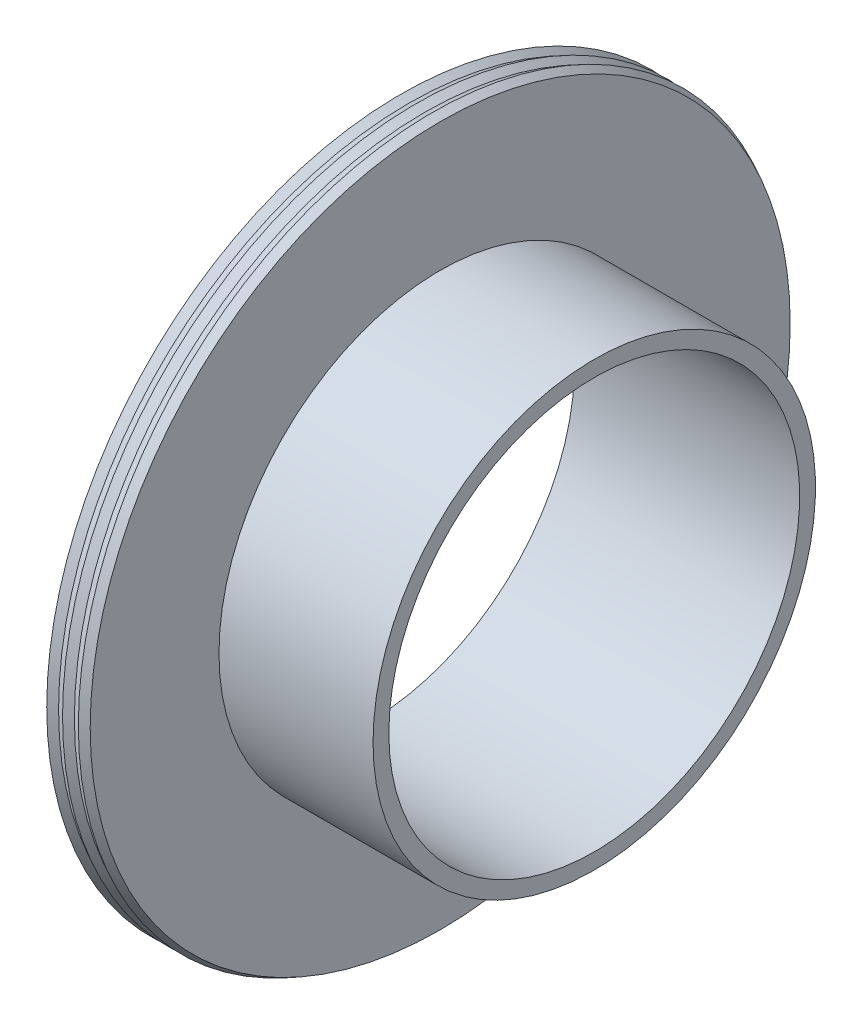
from build123d import *


with BuildPart() as part:
    # 草图1 → 旋转1 (revolve)
    with BuildSketch(Plane.XY, mode=Mode.PRIVATE) as revolve_1_sk:
        Polygon((0, 28), (0, 26), (28.5, 26), (28.5, 28), (9, 28), (9, 44.3), (8, 44.8), (7, 44.3), (6, 44.8), (5, 44.3), (4, 44.8), (4, 28), align=None)
    revolve(revolve_1_sk.sketch.rotate(Axis((-59.659258107, 0, 0), (1, 0, 0)), 90), axis=Axis((-59.659258107, 0, 0), (1, 0, 0)))


solid = part.part
